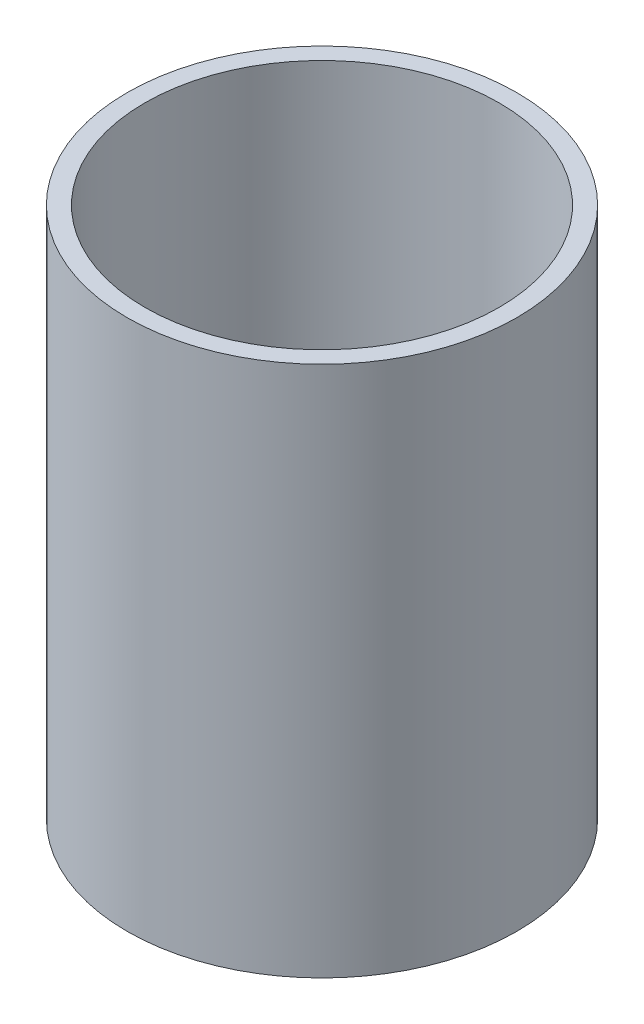
from build123d import *

# Parameters (mm, degrees)
SKETCH_1_R          = 55
EXTRUDE_1_DEPTH     = 150
SKETCH_2_R          = 50
CUT_EXTRUDE_1_DEPTH = 145
SKETCH_3_R          = 13.75
CUT_EXTRUDE_2_DEPTH = 169.967452487


with BuildPart() as part:
    # 草图1 → 拉伸1 (new body)
    with BuildSketch(Plane(origin=(0, 0, 0), x_dir=(1, 0, 0), z_dir=(0, 1, 0))):
        with Locations(Location((0, 0, 0), (0, 0, 270))):
            Circle(SKETCH_1_R)
    extrude(amount=EXTRUDE_1_DEPTH)

    # 草图2 → 切除-拉伸1 (cut)
    with BuildSketch(Plane(origin=(0, 150, 0), x_dir=(-1, 0, 0), z_dir=(0, 1, 0))):
        with Locations(Location((0, 0, 0), (0, 0, 90))):
            Circle(SKETCH_2_R)
    extrude(amount=-CUT_EXTRUDE_1_DEPTH, mode=Mode.SUBTRACT)

    # 草图3 → 切除-拉伸2 (cut, through all)
    with BuildSketch(Plane.XZ):
        with Locations(Location((0, 0, 0), (0, 0, 270))):
            Circle(SKETCH_3_R)
    extrude(amount=-CUT_EXTRUDE_2_DEPTH, mode=Mode.SUBTRACT)


solid = part.part
